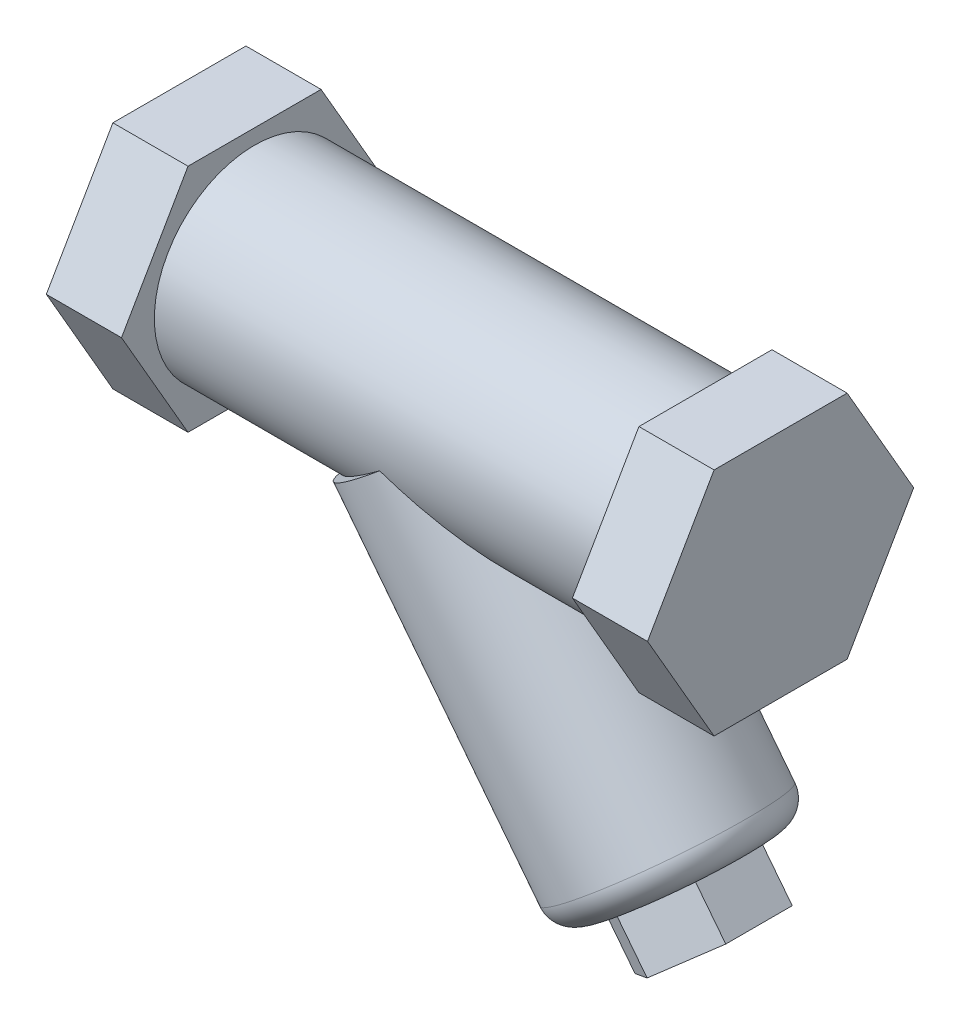
from build123d import *

# Parameters (mm, degrees)
EXTRUDE_417_DEPTH = 15
SKETCH_2_R        = 20
EXTRUDE_1_DEPTH   = 90
EXTRUDE_2_DEPTH   = 15
SKETCH_6_R        = 20
EXTRUDE_5_DEPTH   = 72
EXTRUDE_6_DEPTH   = 10
FILLET_5_R        = 5


with BuildPart() as part:
    # Эскиз1 → Extrude 417 (new body)
    with BuildSketch(Plane(origin=(0, 0, 0), x_dir=(0, 0, -1), z_dir=(1, 0, 0))):
        Polygon((26.558112383, 0), (13.279056191, 23), (-13.279056191, 23), (-26.558112383, 0), (-13.279056191, -23), (13.279056191, -23), align=None)
    extrude(amount=EXTRUDE_417_DEPTH)

    # Эскиз2 → Бобышка-Вытянуть1 (add)
    with BuildSketch(Plane(origin=(15, 0, 0), x_dir=(0, 0, -1), z_dir=(1, 0, 0))):
        with Locations(Location((0, 0, 0), (0, 0, 180))):
            Circle(SKETCH_2_R)
    extrude(amount=EXTRUDE_1_DEPTH)

    # Эскиз3 → Бобышка-Вытянуть2 (add)
    with BuildSketch(Plane(origin=(105, 0, 0), x_dir=(0, 0, -1), z_dir=(1, 0, 0))):
        Polygon((26.558112383, 0), (13.279056191, 23), (-13.279056191, 23), (-26.558112383, 0), (-13.279056191, -23), (13.279056191, -23), align=None)
    extrude(amount=EXTRUDE_2_DEPTH)

    # Эскиз6 → Бобышка-Вытянуть5 (add)
    with BuildSketch(Plane(origin=(24.626459013, -31.520430144, 0), x_dir=(0, 0, 1), z_dir=(-0.6156614753256595, 0.7880107536067209, 0))):
        with Locations(Location((0, 40, 0), (0, 0, 270))):
            Circle(SKETCH_6_R)
    extrude(amount=-EXTRUDE_5_DEPTH)

    # Эскиз7 → Бобышка-Вытянуть6 (add)
    with BuildSketch(Plane(origin=(68.954085236, -88.257204404, 0), x_dir=(0, 0, -1), z_dir=(0.6156614753256596, -0.788010753606721, 0))):
        Polygon((6.635774784, 51.493499074), (-6.635774784, 51.493499074), (-13.271549568, 40), (-6.635774784, 28.506500926), (6.635774784, 28.506500926), (13.271549568, 40), align=None)
    extrude(amount=EXTRUDE_6_DEPTH)

    # Скругление5
    fillet_5_edges = [part.edges().sort_by_distance(p)[0] for p in [
        (116.234730453, -51.317515884, 0),
    ]]
    fillet(fillet_5_edges, radius=FILLET_5_R)


solid = part.part
